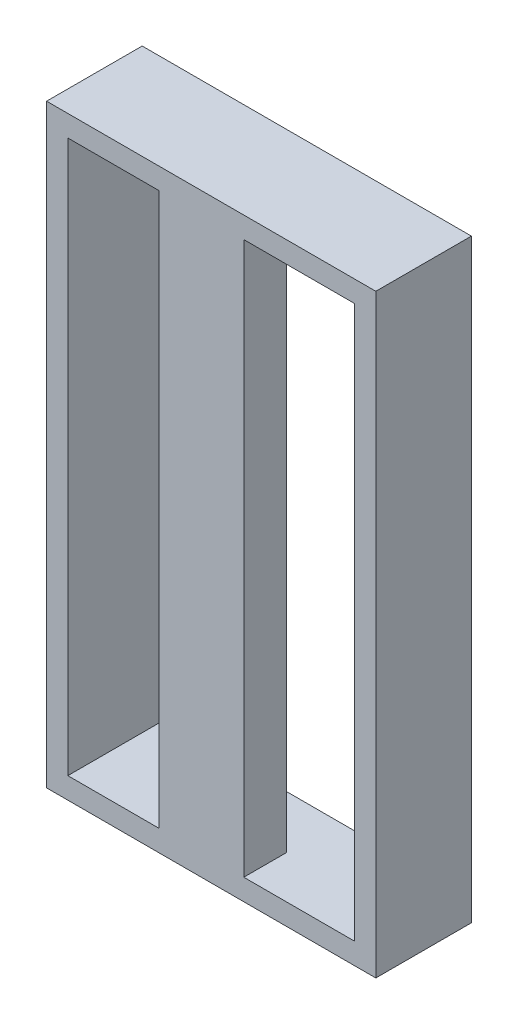
from build123d import *

# Parameters (mm, degrees)
SKETCH1_W           = 56
SKETCH1_H           = 31
BOSS_EXTRUDE1_DEPTH = 9
SKETCH2_W           = 27
SKETCH2_H           = 52
CUT_EXTRUDE1_DEPTH  = 65.637450445
SKETCH3_W           = 8
SKETCH3_H           = 52
BOSS_EXTRUDE2_DEPTH = 4


with BuildPart() as part:
    # Sketch1 → Boss-Extrude1 (new body)
    with BuildSketch(Plane(origin=(0, 0, 0), x_dir=(0, 1, 0), z_dir=(0, 0, 1))):
        with Locations((28, 15.5)):
            Rectangle(SKETCH1_W, SKETCH1_H)
    extrude(amount=BOSS_EXTRUDE1_DEPTH)

    # Sketch2 → Cut-Extrude1 (cut, through all)
    with BuildSketch(Plane.XY.offset(9)):
        with Locations((-15.5, 28)):
            Rectangle(SKETCH2_W, SKETCH2_H)
    extrude(amount=-CUT_EXTRUDE1_DEPTH, mode=Mode.SUBTRACT)

    # Sketch3 → Boss-Extrude2 (add)
    with BuildSketch(Plane.XY.offset(9)):
        with Locations((-16.433368265, 28)):
            Rectangle(SKETCH3_W, SKETCH3_H)
    extrude(amount=-BOSS_EXTRUDE2_DEPTH)


solid = part.part
